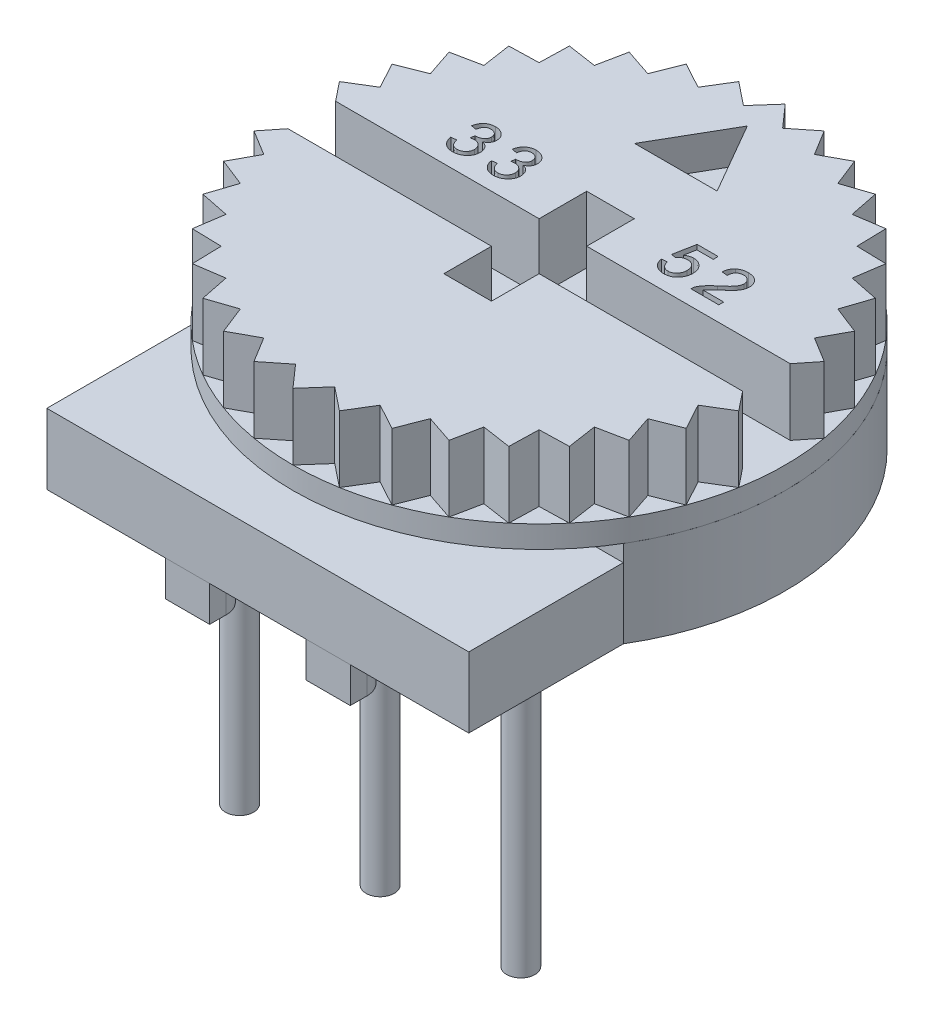
from build123d import *

# Parameters (mm, degrees)
EXTRUDE_START          = 0.64
EXTRUDE_1_DEPTH        = 1.27
EXTRUDE_2_DEPTH        = 0.3
EXTRUDE_START_2        = 2.21
SKETCH_3_R             = 4.445
EXTRUDE_3_DEPTH        = 1.6
SKETCH_4_R             = 1
EXTRUDE_4_DEPTH        = 0.64
EXTRUDE_4_2_DEPTH      = 0.64
EXTRUDE_4_3_DEPTH      = 0.64
EXTRUDE_4_4_DEPTH      = 0.64
EXTRUDE_4_5_DEPTH      = 0.64
EXTRUDE_5_DEPTH        = 0.64
EXTRUDE_5_DEPTH_BACK   = 4.75
SKETCH_5_R             = 0.255
EXTRUDE_5_2_DEPTH      = 0.64
EXTRUDE_5_2_DEPTH_BACK = 4.75
EXTRUDE_5_3_DEPTH      = 0.64
EXTRUDE_5_3_DEPTH_BACK = 4.75
SKETCH_6_R             = 6
CUT_EXTRUDE_1_DEPTH    = 1.2
CUT_EXTRUDE_START      = 3.81
CUT_EXTRUDE_2_DEPTH    = 0.6
CUT_EXTRUDE_3_DEPTH    = 0.3


with BuildPart() as part:
    # Эскиз1 → Бобышка-Вытянуть1 (new body)
    with BuildSketch(Plane(origin=(0, 0, 0), x_dir=(1, 0, 0), z_dir=(0, 1, 0)).offset(EXTRUDE_START)):
        with BuildLine():
            Line((-3.81, -2.28952506), (-3.81, -5.08))
            Line((-3.81, -5.08), (3.81, -5.08))
            Line((3.81, -5.08), (3.81, -2.28952506))
            ThreePointArc((3.81, -2.28952506), (0, 4.445), (-3.81, -2.28952506))
        make_face()
    extrude(amount=EXTRUDE_1_DEPTH)

    # Эскиз2 → Бобышка-Вытянуть2 (add)
    with BuildSketch(Plane(origin=(0, 1.91, 1.91), x_dir=(1, 0, 0), z_dir=(0, 1, 0))):
        with BuildLine():
            Line((-3.81, -0.37952506), (3.81, -0.37952506))
            ThreePointArc((3.81, -0.37952506), (0, 6.355), (-3.81, -0.37952506))
        make_face()
    extrude(amount=EXTRUDE_2_DEPTH)


with BuildPart() as body_2:
    # Эскиз3 → Бобышка-Вытянуть3 (new body)
    with BuildSketch(Plane(origin=(0, 0, 0), x_dir=(1, 0, 0), z_dir=(0, 1, 0)).offset(EXTRUDE_START_2)):
        with Locations(Location((0, 0, 0), (0, 0, 270))):
            Circle(SKETCH_3_R)
    extrude(amount=EXTRUDE_3_DEPTH)

    # Эскиз6 → Вырез-Вытянуть1 (cut)
    with BuildSketch(Plane(origin=(0, 3.81, -3.81), x_dir=(1, 0, 0), z_dir=(0, -1, 0))):
        with Locations((0, 3.81)):
            Circle(SKETCH_6_R)
        Polygon((0, -0.635), (-0.353852316, -0.234550474), (-0.77186615, -0.567470462), (-1.050805323, -0.111658855), (-1.520279537, -0.366933699), (-1.715830143, 0.130390385), (-2.2225, -0.03948292), (-2.328720332, 0.4842427), (-2.857190925, 0.40493245), (-2.870853532, 0.939146468), (-3.40506755, 0.952809075), (-3.3257573, 1.481279668), (-3.84948292, 1.5875), (-3.679609615, 2.094169857), (-4.176933699, 2.289720463), (-3.921658855, 2.759194677), (-4.377470462, 3.03813385), (-4.105196999, 3.38), (-0.43, 3.38), (-0.43, 2.52), (0.43, 2.52), (0.43, 3.38), (4.105196999, 3.38), (4.377470462, 3.03813385), (3.921658855, 2.759194677), (4.176933699, 2.289720463), (3.679609615, 2.094169857), (3.84948292, 1.5875), (3.3257573, 1.481279668), (3.40506755, 0.952809075), (2.870853532, 0.939146468), (2.857190925, 0.40493245), (2.328720332, 0.4842427), (2.2225, -0.03948292), (1.715830143, 0.130390385), (1.520279537, -0.366933699), (1.050805323, -0.111658855), (0.77186615, -0.567470462), (0.353852316, -0.234550474), align=None, mode=Mode.SUBTRACT)
        Polygon((-4.377470462, 4.58186615), (-4.105196999, 4.24), (-0.43, 4.24), (-0.43, 5.1), (0.43, 5.1), (0.43, 4.24), (4.105196999, 4.24), (4.377470462, 4.58186615), (3.921658855, 4.860805323), (4.176933699, 5.330279537), (3.679609615, 5.525830143), (3.84948292, 6.0325), (3.3257573, 6.138720332), (3.40506755, 6.667190925), (2.870853532, 6.680853532), (2.857190925, 7.21506755), (2.328720332, 7.1357573), (2.2225, 7.65948292), (1.715830143, 7.489609615), (1.520279537, 7.986933699), (1.050805323, 7.731658855), (0.77186615, 8.187470462), (0.353852316, 7.854550474), (0, 8.255), (-0.353852316, 7.854550474), (-0.77186615, 8.187470462), (-1.050805323, 7.731658855), (-1.520279537, 7.986933699), (-1.715830143, 7.489609615), (-2.2225, 7.65948292), (-2.328720332, 7.1357573), (-2.857190925, 7.21506755), (-2.870853532, 6.680853532), (-3.40506755, 6.667190925), (-3.3257573, 6.138720332), (-3.84948292, 6.0325), (-3.679609615, 5.525830143), (-4.176933699, 5.330279537), (-3.921658855, 4.860805323), align=None, mode=Mode.SUBTRACT)
    extrude(amount=CUT_EXTRUDE_1_DEPTH, mode=Mode.SUBTRACT)

    # Эскиз7 → Вырез-Вытянуть2 (cut)
    with BuildSketch(Plane(origin=(0, 0, 0), x_dir=(1, 0, 0), z_dir=(0, 1, 0)).offset(CUT_EXTRUDE_START)):
        Polygon((0, 3.76), (-0.744781847, 2.47), (0.744781847, 2.47), align=None)
    extrude(amount=-CUT_EXTRUDE_2_DEPTH, mode=Mode.SUBTRACT)

    # Эскиз8 → Вырез-Вытянуть3 (cut)
    with BuildSketch(Plane(origin=(0, 0, 0), x_dir=(1, 0, 0), z_dir=(0, 1, 0)).offset(CUT_EXTRUDE_START)):
        with BuildLine():
            Line((-2.501985822, 0.907038993), (-2.40690864, 0.919541025))
            add(Edge.make_bspline(
                [(-2.40690864, 0.919541025), (-2.405644351, 0.913657796), (-2.403175537, 0.902169439), (-2.39834592, 0.885699646), (-2.392970764, 0.870309421), (-2.386847582, 0.856085424), (-2.379831703, 0.843084522), (-2.372294366, 0.831093845), (-2.363915838, 0.820249984), (-2.35483828, 0.810450789), (-2.344863046, 0.801980649), (-2.334355165, 0.794448083), (-2.322966638, 0.788275038), (-2.310909145, 0.78320574), (-2.298172434, 0.779108802), (-2.284654514, 0.776412792), (-2.270460532, 0.774670777), (-2.2607482, 0.774425987), (-2.255803833, 0.774301369)],
                knots=[0, 0, 0, 0, 1.25215365, 2.445118067, 3.569595109, 4.643898417, 5.664387673, 6.64176914, 7.588516002, 8.512830437, 9.416505071, 10.307849468, 11.199258191, 12.106226295, 13.027433782, 13.978832694, 14.971061312, 16, 16, 16, 16], degree=3))
            add(Edge.make_bspline(
                [(-2.255803833, 0.774301369), (-2.250499607, 0.774475489), (-2.240008423, 0.774819881), (-2.224526828, 0.776778658), (-2.209648892, 0.780374105), (-2.195334767, 0.785353184), (-2.181578723, 0.791694865), (-2.168331978, 0.799421779), (-2.155890017, 0.808838811), (-2.143823297, 0.819162981), (-2.133017033, 0.830846954), (-2.123392866, 0.843229205), (-2.115056093, 0.856275085), (-2.108457683, 0.870196614), (-2.103370893, 0.88480763), (-2.099604129, 0.900037795), (-2.097447851, 0.916032165), (-2.097139121, 0.926943291), (-2.096981722, 0.932506095)],
                knots=[0, 0, 0, 0, 1.019841494, 2.017136108, 2.993418084, 3.956740548, 4.925832977, 5.90111261, 6.898014859, 7.921398643, 8.949977907, 9.950943466, 10.933218023, 11.919665724, 12.904922903, 13.902756767, 14.930765338, 16, 16, 16, 16], degree=3))
            add(Edge.make_bspline(
                [(-2.096981722, 0.932506095), (-2.09706827, 0.937711239), (-2.097238734, 0.947963224), (-2.099537355, 0.962934875), (-2.10290923, 0.977315591), (-2.107663642, 0.991050748), (-2.113893368, 1.004053995), (-2.121402738, 1.016436902), (-2.130299077, 1.028139768), (-2.137191539, 1.035263821), (-2.140661661, 1.038850541)],
                knots=[0, 0, 0, 0, 1.055738822, 2.07936994, 3.067371846, 4.051723283, 5.023470754, 5.988967532, 6.98751311, 8, 8, 8, 8], degree=3))
            add(Edge.make_bspline(
                [(-2.140661661, 1.038850541), (-2.144306094, 1.042213096), (-2.151521969, 1.048870861), (-2.16329474, 1.05754641), (-2.17571264, 1.064768971), (-2.188613289, 1.070940279), (-2.202408744, 1.075566782), (-2.217178878, 1.078990189), (-2.233110948, 1.08099687), (-2.244119221, 1.081194174), (-2.249784336, 1.081295712)],
                knots=[0, 0, 0, 0, 0.988530191, 1.957261951, 2.909383301, 3.850436006, 4.804490823, 5.805143527, 6.870475691, 8, 8, 8, 8], degree=3))
            add(Edge.make_bspline(
                [(-2.249784336, 1.081295712), (-2.254729284, 1.081174596), (-2.26511934, 1.080920113), (-2.281362147, 1.078752771), (-2.298970308, 1.07533309), (-2.311074132, 1.072252682), (-2.317387916, 1.070645832)],
                knots=[0, 0, 0, 0, 0.864458614, 1.816353425, 2.860932338, 4, 4, 4, 4], degree=3))
            Line((-2.317387916, 1.070645832), (-2.306738037, 1.149671023))
            Line((-2.306738037, 1.149671023), (-2.291920814, 1.149671023))
            add(Edge.make_bspline(
                [(-2.291920814, 1.149671023), (-2.281908836, 1.150038642), (-2.262312444, 1.150758182), (-2.233916972, 1.156929023), (-2.207447857, 1.167116071), (-2.1870926, 1.178716755), (-2.172340709, 1.189959506), (-2.162732901, 1.199557805), (-2.154596956, 1.210203868), (-2.147917802, 1.221815624), (-2.14284499, 1.234462895), (-2.13908188, 1.24801206), (-2.136947876, 1.262636389), (-2.136648599, 1.272729474), (-2.136494317, 1.277932611)],
                knots=[0, 0, 0, 0, 1.590047677, 3.112191915, 4.592935101, 6.084007372, 6.818461429, 7.535499496, 8.2355482, 8.942536248, 9.657800044, 10.395842031, 11.173032543, 12, 12, 12, 12], degree=3))
            add(Edge.make_bspline(
                [(-2.136494317, 1.277932611), (-2.136619309, 1.282464939), (-2.136861694, 1.291254008), (-2.138557954, 1.304093252), (-2.141528509, 1.316119811), (-2.145449001, 1.327553546), (-2.150982549, 1.338001507), (-2.157343132, 1.347891481), (-2.164882385, 1.357048183), (-2.176689469, 1.367761123), (-2.192712731, 1.379395627), (-2.214107144, 1.389448426), (-2.237158661, 1.395492255), (-2.253092239, 1.396242634), (-2.261205945, 1.396624742)],
                knots=[0, 0, 0, 0, 0.846154037, 1.640857849, 2.411992166, 3.156338538, 3.890952843, 4.612962146, 5.349645879, 6.097269828, 7.584598448, 9.028361454, 10.486780392, 12, 12, 12, 12], degree=3))
            add(Edge.make_bspline(
                [(-2.261205945, 1.396624742), (-2.265941947, 1.396479956), (-2.275232891, 1.396195917), (-2.288845513, 1.394742828), (-2.301626515, 1.391896189), (-2.313722162, 1.388233046), (-2.324993347, 1.38326957), (-2.335498967, 1.37720153), (-2.345384597, 1.370248959), (-2.354320856, 1.361982869), (-2.362565267, 1.352686373), (-2.369895989, 1.34224472), (-2.376861602, 1.330971723), (-2.382568944, 1.318336548), (-2.387932399, 1.304795904), (-2.392109882, 1.290018356), (-2.395912528, 1.274283813), (-2.397670873, 1.263336021), (-2.398573952, 1.257713275)],
                knots=[0, 0, 0, 0, 1.047698147, 2.05534196, 3.021606887, 3.939224836, 4.846058591, 5.73792374, 6.61876291, 7.512657664, 8.423479399, 9.361190499, 10.330932173, 11.348864526, 12.422194489, 13.549004293, 14.741177672, 16, 16, 16, 16], degree=3))
            Line((-2.398573952, 1.257713275), (-2.492416365, 1.273919613))
            add(Edge.make_bspline(
                [(-2.492416365, 1.273919613), (-2.490926561, 1.281865412), (-2.488021886, 1.29735735), (-2.481994505, 1.319733397), (-2.474459047, 1.340672408), (-2.465276194, 1.360122295), (-2.454996064, 1.378286564), (-2.44317597, 1.394958758), (-2.429833812, 1.41011232), (-2.415168968, 1.423883062), (-2.399296787, 1.436005668), (-2.382475556, 1.446637702), (-2.364670307, 1.455568296), (-2.345989266, 1.462998359), (-2.326408754, 1.468755207), (-2.305887111, 1.472697023), (-2.284474667, 1.4752646), (-2.26985689, 1.475520237), (-2.262440714, 1.475649933)],
                knots=[0, 0, 0, 0, 1.151933863, 2.245927202, 3.299073903, 4.319309306, 5.307986268, 6.270398158, 7.226503678, 8.18108947, 9.132967531, 10.068836926, 11.013314105, 11.96787173, 12.930842188, 13.917395712, 14.943412426, 16, 16, 16, 16], degree=3))
            add(Edge.make_bspline(
                [(-2.262440714, 1.475649933), (-2.254922121, 1.475460825), (-2.240044918, 1.475086634), (-2.218135904, 1.472452289), (-2.197001473, 1.467975698), (-2.176762165, 1.461623555), (-2.157275529, 1.453534369), (-2.138630425, 1.443654641), (-2.120736227, 1.432002215), (-2.103966896, 1.418648161), (-2.088403134, 1.404196699), (-2.07488156, 1.388483927), (-2.063419813, 1.371914544), (-2.053911799, 1.354568805), (-2.046562396, 1.336340438), (-2.0415229, 1.317200456), (-2.038343476, 1.297228818), (-2.037924964, 1.283603975), (-2.037712829, 1.276697842)],
                knots=[0, 0, 0, 0, 1.080881225, 2.138763162, 3.167379081, 4.182744089, 5.184191339, 6.196723254, 7.212303792, 8.249712366, 9.275371759, 10.261429635, 11.223757434, 12.167135395, 13.099809543, 14.041823507, 15.00744346, 16, 16, 16, 16], degree=3))
            add(Edge.make_bspline(
                [(-2.037712829, 1.276697842), (-2.03798463, 1.268493386), (-2.038517751, 1.252400896), (-2.043455337, 1.228981216), (-2.051578623, 1.206945589), (-2.062866169, 1.186226186), (-2.077786153, 1.167223022), (-2.096144392, 1.149853801), (-2.118228696, 1.134424264), (-2.134736006, 1.12596256), (-2.143285544, 1.121580037)],
                knots=[0, 0, 0, 0, 0.987492271, 1.936899646, 2.868413649, 3.808814761, 4.767243983, 5.766897543, 6.843421767, 8, 8, 8, 8], degree=3))
            add(Edge.make_bspline(
                [(-2.143285544, 1.121580037), (-2.137654276, 1.12038866), (-2.126576692, 1.118045036), (-2.110622959, 1.112959632), (-2.095719565, 1.106409554), (-2.081769358, 1.098659598), (-2.068689821, 1.089733046), (-2.056809274, 1.079251044), (-2.045712723, 1.067684431), (-2.036021266, 1.05465431), (-2.027060141, 1.041045247), (-2.019348794, 1.026829565), (-2.012857342, 1.012207367), (-2.007354458, 0.997297309), (-2.003475294, 0.981841714), (-2.000223572, 0.966115889), (-1.998610008, 0.949878017), (-1.998337466, 0.938939841), (-1.998200234, 0.933432172)],
                knots=[0, 0, 0, 0, 1.067131883, 2.099215043, 3.099123068, 4.081576142, 5.055651918, 6.029634208, 7.015141117, 8.022850411, 9.036550921, 10.03573015, 11.018183224, 12.00221067, 12.978947031, 13.970808847, 14.97824702, 16, 16, 16, 16], degree=3))
            add(Edge.make_bspline(
                [(-1.998200234, 0.933432172), (-1.998443868, 0.92508559), (-1.998922875, 0.908675465), (-2.002514264, 0.884593489), (-2.008594923, 0.861647131), (-2.0168699, 0.839644174), (-2.028070828, 0.818959188), (-2.041109562, 0.799027081), (-2.056957149, 0.78042788), (-2.074813227, 0.763046374), (-2.094344038, 0.747265569), (-2.114914563, 0.733223833), (-2.136570724, 0.721529218), (-2.159078528, 0.711868726), (-2.182498369, 0.704425723), (-2.206902033, 0.69923801), (-2.232198097, 0.695871696), (-2.249413421, 0.695476184), (-2.258119024, 0.695276178)],
                knots=[0, 0, 0, 0, 1.020466717, 2.006328551, 2.969258575, 3.919193331, 4.873285916, 5.83999038, 6.826795306, 7.854547782, 8.883320379, 9.893671155, 10.895899107, 11.888064533, 12.884926533, 13.89559068, 14.935823028, 16, 16, 16, 16], degree=3))
            add(Edge.make_bspline(
                [(-2.258119024, 0.695276178), (-2.266514424, 0.695433193), (-2.282998584, 0.695741487), (-2.307107981, 0.698777869), (-2.330045612, 0.70351683), (-2.351835599, 0.710154005), (-2.372397677, 0.718830679), (-2.391867351, 0.729385714), (-2.410105191, 0.741931679), (-2.427010156, 0.756257142), (-2.442384661, 0.771977868), (-2.456147671, 0.788675018), (-2.468278692, 0.806202262), (-2.478696388, 0.824609983), (-2.487156179, 0.843991857), (-2.493971023, 0.864177463), (-2.499195774, 0.885230761), (-2.50104797, 0.899708334), (-2.501985822, 0.907038993)],
                knots=[0, 0, 0, 0, 1.131891259, 2.222440238, 3.271761995, 4.288072932, 5.289491361, 6.276963531, 7.270173475, 8.269762916, 9.261007282, 10.232154035, 11.184979397, 12.132661093, 13.08034279, 14.032738467, 15.00388522, 16, 16, 16, 16], degree=3))
        make_face()
        with BuildLine():
            Line((-1.767051552, 0.907038993), (-1.67197437, 0.919541025))
            add(Edge.make_bspline(
                [(-1.67197437, 0.919541025), (-1.670710082, 0.913657796), (-1.668241268, 0.902169439), (-1.66341165, 0.885699646), (-1.658036494, 0.870309421), (-1.651913312, 0.856085424), (-1.644897433, 0.843084522), (-1.637360096, 0.831093845), (-1.628981568, 0.820249984), (-1.61990401, 0.810450789), (-1.609928777, 0.801980649), (-1.599420896, 0.794448083), (-1.588032368, 0.788275038), (-1.575974876, 0.78320574), (-1.563238164, 0.779108802), (-1.549720244, 0.776412792), (-1.535526262, 0.774670777), (-1.52581393, 0.774425987), (-1.520869563, 0.774301369)],
                knots=[0, 0, 0, 0, 1.25215365, 2.445118067, 3.569595109, 4.643898417, 5.664387673, 6.64176914, 7.588516002, 8.512830437, 9.416505071, 10.307849468, 11.199258191, 12.106226295, 13.027433782, 13.978832694, 14.971061312, 16, 16, 16, 16], degree=3))
            add(Edge.make_bspline(
                [(-1.520869563, 0.774301369), (-1.515565337, 0.774475489), (-1.505074153, 0.774819881), (-1.489592558, 0.776778658), (-1.474714623, 0.780374105), (-1.460400497, 0.785353184), (-1.446644453, 0.791694865), (-1.433397708, 0.799421779), (-1.420955747, 0.808838811), (-1.408889027, 0.819162981), (-1.398082763, 0.830846954), (-1.388458596, 0.843229205), (-1.380121823, 0.856275085), (-1.373523413, 0.870196614), (-1.368436623, 0.88480763), (-1.364669859, 0.900037795), (-1.362513581, 0.916032165), (-1.362204851, 0.926943291), (-1.362047452, 0.932506095)],
                knots=[0, 0, 0, 0, 1.019841494, 2.017136108, 2.993418084, 3.956740548, 4.925832977, 5.90111261, 6.898014859, 7.921398643, 8.949977907, 9.950943466, 10.933218023, 11.919665724, 12.904922903, 13.902756767, 14.930765338, 16, 16, 16, 16], degree=3))
            add(Edge.make_bspline(
                [(-1.362047452, 0.932506095), (-1.362134, 0.937711239), (-1.362304464, 0.947963224), (-1.364603085, 0.962934875), (-1.36797496, 0.977315591), (-1.372729372, 0.991050748), (-1.378959098, 1.004053995), (-1.386468468, 1.016436902), (-1.395364807, 1.028139768), (-1.402257269, 1.035263821), (-1.405727391, 1.038850541)],
                knots=[0, 0, 0, 0, 1.055738822, 2.07936994, 3.067371846, 4.051723283, 5.023470754, 5.988967532, 6.98751311, 8, 8, 8, 8], degree=3))
            add(Edge.make_bspline(
                [(-1.405727391, 1.038850541), (-1.409371824, 1.042213096), (-1.416587699, 1.048870861), (-1.42836047, 1.05754641), (-1.44077837, 1.064768971), (-1.453679019, 1.070940279), (-1.467474474, 1.075566782), (-1.482244608, 1.078990189), (-1.498176678, 1.08099687), (-1.509184952, 1.081194174), (-1.514850066, 1.081295712)],
                knots=[0, 0, 0, 0, 0.988530191, 1.957261951, 2.909383301, 3.850436006, 4.804490823, 5.805143527, 6.870475691, 8, 8, 8, 8], degree=3))
            add(Edge.make_bspline(
                [(-1.514850066, 1.081295712), (-1.519795014, 1.081174596), (-1.530185071, 1.080920113), (-1.546427877, 1.078752771), (-1.564036038, 1.07533309), (-1.576139862, 1.072252682), (-1.582453647, 1.070645832)],
                knots=[0, 0, 0, 0, 0.864458614, 1.816353425, 2.860932338, 4, 4, 4, 4], degree=3))
            Line((-1.582453647, 1.070645832), (-1.571803767, 1.149671023))
            Line((-1.571803767, 1.149671023), (-1.556986544, 1.149671023))
            add(Edge.make_bspline(
                [(-1.556986544, 1.149671023), (-1.546974566, 1.150038642), (-1.527378174, 1.150758182), (-1.498982702, 1.156929023), (-1.472513587, 1.167116071), (-1.45215833, 1.178716755), (-1.437406439, 1.189959506), (-1.427798631, 1.199557805), (-1.419662686, 1.210203868), (-1.412983532, 1.221815624), (-1.40791072, 1.234462895), (-1.40414761, 1.24801206), (-1.402013606, 1.262636389), (-1.401714329, 1.272729474), (-1.401560047, 1.277932611)],
                knots=[0, 0, 0, 0, 1.590047677, 3.112191915, 4.592935101, 6.084007372, 6.818461429, 7.535499496, 8.2355482, 8.942536248, 9.657800044, 10.395842031, 11.173032543, 12, 12, 12, 12], degree=3))
            add(Edge.make_bspline(
                [(-1.401560047, 1.277932611), (-1.401685039, 1.282464939), (-1.401927424, 1.291254008), (-1.403623684, 1.304093252), (-1.406594239, 1.316119811), (-1.410514731, 1.327553546), (-1.416048279, 1.338001507), (-1.422408862, 1.347891481), (-1.429948115, 1.357048183), (-1.441755199, 1.367761123), (-1.457778461, 1.379395627), (-1.479172874, 1.389448426), (-1.502224391, 1.395492255), (-1.518157969, 1.396242634), (-1.526271675, 1.396624742)],
                knots=[0, 0, 0, 0, 0.846154037, 1.640857849, 2.411992166, 3.156338538, 3.890952843, 4.612962146, 5.349645879, 6.097269828, 7.584598448, 9.028361454, 10.486780392, 12, 12, 12, 12], degree=3))
            add(Edge.make_bspline(
                [(-1.526271675, 1.396624742), (-1.531007678, 1.396479956), (-1.540298621, 1.396195917), (-1.553911243, 1.394742828), (-1.566692245, 1.391896189), (-1.578787892, 1.388233046), (-1.590059077, 1.38326957), (-1.600564697, 1.37720153), (-1.610450327, 1.370248959), (-1.619386586, 1.361982869), (-1.627630997, 1.352686373), (-1.634961719, 1.34224472), (-1.641927332, 1.330971723), (-1.647634674, 1.318336548), (-1.652998129, 1.304795904), (-1.657175613, 1.290018356), (-1.660978259, 1.274283813), (-1.662736603, 1.263336021), (-1.663639682, 1.257713275)],
                knots=[0, 0, 0, 0, 1.047698147, 2.05534196, 3.021606887, 3.939224836, 4.846058591, 5.73792374, 6.61876291, 7.512657664, 8.423479399, 9.361190499, 10.330932173, 11.348864526, 12.422194489, 13.549004293, 14.741177672, 16, 16, 16, 16], degree=3))
            Line((-1.663639682, 1.257713275), (-1.757482095, 1.273919613))
            add(Edge.make_bspline(
                [(-1.757482095, 1.273919613), (-1.755992291, 1.281865412), (-1.753087617, 1.29735735), (-1.747060235, 1.319733397), (-1.739524777, 1.340672408), (-1.730341924, 1.360122295), (-1.720061794, 1.378286564), (-1.708241701, 1.394958758), (-1.694899542, 1.41011232), (-1.680234698, 1.423883062), (-1.664362517, 1.436005668), (-1.647541286, 1.446637702), (-1.629736037, 1.455568296), (-1.611054996, 1.462998359), (-1.591474485, 1.468755207), (-1.570952841, 1.472697023), (-1.549540397, 1.4752646), (-1.53492262, 1.475520237), (-1.527506444, 1.475649933)],
                knots=[0, 0, 0, 0, 1.151933863, 2.245927202, 3.299073903, 4.319309306, 5.307986268, 6.270398158, 7.226503678, 8.18108947, 9.132967531, 10.068836926, 11.013314105, 11.96787173, 12.930842188, 13.917395712, 14.943412426, 16, 16, 16, 16], degree=3))
            add(Edge.make_bspline(
                [(-1.527506444, 1.475649933), (-1.519987851, 1.475460825), (-1.505110648, 1.475086634), (-1.483201635, 1.472452289), (-1.462067203, 1.467975698), (-1.441827895, 1.461623555), (-1.422341259, 1.453534369), (-1.403696155, 1.443654641), (-1.385801957, 1.432002215), (-1.369032627, 1.418648161), (-1.353468864, 1.404196699), (-1.339947291, 1.388483927), (-1.328485543, 1.371914544), (-1.318977529, 1.354568805), (-1.311628126, 1.336340438), (-1.30658863, 1.317200456), (-1.303409207, 1.297228818), (-1.302990694, 1.283603975), (-1.302778559, 1.276697842)],
                knots=[0, 0, 0, 0, 1.080881225, 2.138763162, 3.167379081, 4.182744089, 5.184191339, 6.196723254, 7.212303792, 8.249712366, 9.275371759, 10.261429635, 11.223757434, 12.167135395, 13.099809543, 14.041823507, 15.00744346, 16, 16, 16, 16], degree=3))
            add(Edge.make_bspline(
                [(-1.302778559, 1.276697842), (-1.303050361, 1.268493386), (-1.303583481, 1.252400896), (-1.308521067, 1.228981216), (-1.316644353, 1.206945589), (-1.327931899, 1.186226186), (-1.342851883, 1.167223022), (-1.361210122, 1.149853801), (-1.383294426, 1.134424264), (-1.399801736, 1.12596256), (-1.408351274, 1.121580037)],
                knots=[0, 0, 0, 0, 0.987492271, 1.936899646, 2.868413649, 3.808814761, 4.767243983, 5.766897543, 6.843421767, 8, 8, 8, 8], degree=3))
            add(Edge.make_bspline(
                [(-1.408351274, 1.121580037), (-1.402720006, 1.12038866), (-1.391642422, 1.118045036), (-1.375688689, 1.112959632), (-1.360785295, 1.106409554), (-1.346835088, 1.098659598), (-1.333755551, 1.089733046), (-1.321875005, 1.079251044), (-1.310778453, 1.067684431), (-1.301086996, 1.05465431), (-1.292125871, 1.041045247), (-1.284414525, 1.026829565), (-1.277923072, 1.012207367), (-1.272420188, 0.997297309), (-1.268541024, 0.981841714), (-1.265289302, 0.966115889), (-1.263675738, 0.949878017), (-1.263403196, 0.938939841), (-1.263265964, 0.933432172)],
                knots=[0, 0, 0, 0, 1.067131883, 2.099215043, 3.099123068, 4.081576142, 5.055651918, 6.029634208, 7.015141117, 8.022850411, 9.036550921, 10.03573015, 11.018183224, 12.00221067, 12.978947031, 13.970808847, 14.97824702, 16, 16, 16, 16], degree=3))
            add(Edge.make_bspline(
                [(-1.263265964, 0.933432172), (-1.263509598, 0.92508559), (-1.263988605, 0.908675465), (-1.267579994, 0.884593489), (-1.273660653, 0.861647131), (-1.28193563, 0.839644174), (-1.293136558, 0.818959188), (-1.306175292, 0.799027081), (-1.322022879, 0.78042788), (-1.339878957, 0.763046374), (-1.359409768, 0.747265569), (-1.379980293, 0.733223833), (-1.401636454, 0.721529218), (-1.424144258, 0.711868726), (-1.447564099, 0.704425723), (-1.471967763, 0.69923801), (-1.497263827, 0.695871696), (-1.514479151, 0.695476184), (-1.523184754, 0.695276178)],
                knots=[0, 0, 0, 0, 1.020466717, 2.006328551, 2.969258575, 3.919193331, 4.873285916, 5.83999038, 6.826795306, 7.854547782, 8.883320379, 9.893671155, 10.895899107, 11.888064533, 12.884926533, 13.89559068, 14.935823028, 16, 16, 16, 16], degree=3))
            add(Edge.make_bspline(
                [(-1.523184754, 0.695276178), (-1.531580155, 0.695433193), (-1.548064314, 0.695741487), (-1.572173712, 0.698777869), (-1.595111343, 0.70351683), (-1.616901329, 0.710154005), (-1.637463407, 0.718830679), (-1.656933082, 0.729385714), (-1.675170921, 0.741931679), (-1.692075886, 0.756257142), (-1.707450391, 0.771977868), (-1.721213402, 0.788675018), (-1.733344422, 0.806202262), (-1.743762118, 0.824609983), (-1.75222191, 0.843991857), (-1.759036753, 0.864177463), (-1.764261505, 0.885230761), (-1.7661137, 0.899708334), (-1.767051552, 0.907038993)],
                knots=[0, 0, 0, 0, 1.131891259, 2.222440238, 3.271761995, 4.288072932, 5.289491361, 6.276963531, 7.270173475, 8.269762916, 9.261007282, 10.232154035, 11.184979397, 12.132661093, 13.08034279, 14.032738467, 15.00388522, 16, 16, 16, 16], degree=3))
        make_face()
        with BuildLine():
            Line((1.307429651, 0.90518684), (1.406828523, 0.912595452))
            add(Edge.make_bspline(
                [(1.406828523, 0.912595452), (1.407726274, 0.906869815), (1.409468971, 0.895755315), (1.413337631, 0.879741168), (1.418255873, 0.864926628), (1.424153803, 0.851246657), (1.430931244, 0.838630347), (1.438811358, 0.827203129), (1.44763734, 0.816929576), (1.457438628, 0.807943513), (1.467983733, 0.800144002), (1.478848812, 0.793143437), (1.490314896, 0.787392968), (1.50212929, 0.782622397), (1.514370029, 0.778887357), (1.52703347, 0.776303385), (1.540079158, 0.774480955), (1.548974866, 0.77436154), (1.553457294, 0.774301369)],
                knots=[0, 0, 0, 0, 1.249067748, 2.424667078, 3.54705271, 4.610222465, 5.63263209, 6.629453051, 7.596709712, 8.546511456, 9.489292943, 10.42164286, 11.329389588, 12.250054795, 13.165829761, 14.08381861, 15.034461889, 16, 16, 16, 16], degree=3))
            add(Edge.make_bspline(
                [(1.553457294, 0.774301369), (1.559231145, 0.77441581), (1.570584715, 0.774640844), (1.587124199, 0.777414663), (1.602924865, 0.781557981), (1.617951853, 0.787449673), (1.632252438, 0.795056993), (1.645693073, 0.804413047), (1.658514577, 0.815276405), (1.670226035, 0.827917089), (1.680955095, 0.841633463), (1.690248799, 0.856318099), (1.698366291, 0.871577647), (1.704830999, 0.88768016), (1.709784511, 0.904487896), (1.713312621, 0.921995507), (1.715520825, 0.9402188), (1.715828024, 0.952616279), (1.715983711, 0.958899274)],
                knots=[0, 0, 0, 0, 1.008988117, 1.984051261, 2.924956246, 3.862541115, 4.800644177, 5.751780646, 6.722097308, 7.7344514, 8.760593165, 9.764228736, 10.770644745, 11.780074283, 12.793827566, 13.831663856, 14.901095515, 16, 16, 16, 16], degree=3))
            add(Edge.make_bspline(
                [(1.715983711, 0.958899274), (1.715814716, 0.965334981), (1.715485354, 0.97787787), (1.713529693, 0.996175263), (1.709994982, 1.013452902), (1.704838644, 1.029633176), (1.698583842, 1.044927901), (1.690632439, 1.059023238), (1.681292, 1.072093567), (1.670664355, 1.084065762), (1.658999094, 1.094925694), (1.646186891, 1.104146091), (1.632760031, 1.112314149), (1.618291538, 1.118811764), (1.602943271, 1.12370836), (1.586822168, 1.127247675), (1.569879172, 1.129466337), (1.558300396, 1.129762971), (1.552376871, 1.129914725)],
                knots=[0, 0, 0, 0, 1.15763473, 2.256175304, 3.305152242, 4.323645506, 5.306671854, 6.271986148, 7.22722391, 8.190895719, 9.147029492, 10.087268737, 11.025182741, 11.969466044, 12.932248857, 13.917885014, 14.934821687, 16, 16, 16, 16], degree=3))
            add(Edge.make_bspline(
                [(1.552376871, 1.129914725), (1.54500727, 1.129662955), (1.53065036, 1.129172475), (1.509730086, 1.125772738), (1.490173041, 1.119890962), (1.47194238, 1.111657925), (1.455037983, 1.101035697), (1.439639275, 1.087943606), (1.425308589, 1.07272944), (1.417374797, 1.061042834), (1.413311058, 1.055056879)],
                knots=[0, 0, 0, 0, 1.069378134, 2.083282909, 3.065914344, 4.024944712, 4.977851872, 5.952965674, 6.951495823, 8, 8, 8, 8], degree=3))
            Line((1.413311058, 1.055056879), (1.324562065, 1.065706758))
            Line((1.324562065, 1.065706758), (1.398185143, 1.455893635))
            Line((1.398185143, 1.455893635), (1.777876487, 1.455893635))
            Line((1.777876487, 1.455893635), (1.777876487, 1.366990296))
            Line((1.777876487, 1.366990296), (1.481840715, 1.366990296))
            Line((1.481840715, 1.366990296), (1.44309985, 1.161864363))
            add(Edge.make_bspline(
                [(1.44309985, 1.161864363), (1.44876287, 1.165594907), (1.459927769, 1.172949844), (1.477281803, 1.182497319), (1.494680045, 1.190711627), (1.512208177, 1.197428854), (1.529838641, 1.202473992), (1.547512116, 1.206264339), (1.565338274, 1.208451933), (1.577272379, 1.208777134), (1.583246086, 1.208939915)],
                knots=[0, 0, 0, 0, 1.083779032, 2.136719571, 3.163308835, 4.157763175, 5.133919324, 6.092133947, 7.045003185, 8, 8, 8, 8], degree=3))
            add(Edge.make_bspline(
                [(1.583246086, 1.208939915), (1.59097097, 1.208713775), (1.606276709, 1.20826571), (1.628823981, 1.205263312), (1.650437417, 1.199620384), (1.67141909, 1.19256766), (1.691388994, 1.182727762), (1.710766966, 1.171290795), (1.729068223, 1.157273378), (1.746528999, 1.141589681), (1.762530536, 1.124117487), (1.776463345, 1.105135151), (1.788532856, 1.085023), (1.798031266, 1.063340298), (1.805703988, 1.04048495), (1.810814615, 1.016185912), (1.814190763, 0.990686736), (1.814571176, 0.973213355), (1.814765199, 0.964301387)],
                knots=[0, 0, 0, 0, 0.985324326, 1.952277578, 2.892821764, 3.830798909, 4.769945844, 5.726467989, 6.696288994, 7.704421374, 8.716964428, 9.711747458, 10.703170494, 11.701862822, 12.724833945, 13.772487079, 14.863899138, 16, 16, 16, 16], degree=3))
            add(Edge.make_bspline(
                [(1.814765199, 0.964301387), (1.814567689, 0.955543813), (1.814177098, 0.938224929), (1.810760944, 0.912683681), (1.805643149, 0.887839023), (1.797980557, 0.86391008), (1.788347337, 0.840716171), (1.776633363, 0.818309613), (1.762606027, 0.796771953), (1.746717496, 0.776227559), (1.728943875, 0.75716293), (1.709021189, 0.740556815), (1.687401786, 0.726433013), (1.663852623, 0.715098934), (1.638718604, 0.706130141), (1.611737979, 0.699871137), (1.583056675, 0.695888489), (1.563297798, 0.695483964), (1.553148602, 0.695276178)],
                knots=[0, 0, 0, 0, 0.998180857, 1.9739917, 2.93362, 3.887312064, 4.834104183, 5.794539127, 6.76601965, 7.761144289, 8.753029812, 9.731781363, 10.711376514, 11.690057732, 12.705061318, 13.748110294, 14.843311327, 16, 16, 16, 16], degree=3))
            add(Edge.make_bspline(
                [(1.553148602, 0.695276178), (1.545270063, 0.69540662), (1.529781304, 0.69566306), (1.506971645, 0.698219061), (1.485021145, 0.702326694), (1.463978004, 0.708241217), (1.443770392, 0.715663363), (1.424422366, 0.7247572), (1.406024927, 0.735694192), (1.388399468, 0.747902675), (1.372121593, 0.761952456), (1.35764805, 0.777787047), (1.344644889, 0.794999508), (1.333685517, 0.814018819), (1.324466166, 0.834576494), (1.316879392, 0.856682227), (1.310934883, 0.880323009), (1.308615817, 0.896772951), (1.307429651, 0.90518684)],
                knots=[0, 0, 0, 0, 1.057065927, 2.078131428, 3.076243397, 4.051326069, 5.008244039, 5.96271726, 6.916065792, 7.877755458, 8.837211347, 9.79502582, 10.752093266, 11.726809112, 12.734335647, 13.771616904, 14.860216757, 16, 16, 16, 16], degree=3))
        make_face()
        with BuildLine():
            Line((2.53982132, 0.794057666), (2.53982132, 0.705154327))
            Line((2.53982132, 0.705154327), (2.036035731, 0.705154327))
            Line((2.036035731, 0.705154327), (2.036035731, 0.720125896))
            add(Edge.make_bspline(
                [(2.036035731, 0.720125896), (2.036185863, 0.72461269), (2.036493185, 0.733797266), (2.039046444, 0.74776814), (2.042579769, 0.762257338), (2.048251327, 0.777007332), (2.054987472, 0.792313906), (2.063339554, 0.808050541), (2.07338641, 0.824097187), (2.084536539, 0.84084533), (2.097647966, 0.857719228), (2.111989126, 0.875228883), (2.127933417, 0.89311447), (2.145394694, 0.911478581), (2.164346944, 0.930254173), (2.184854803, 0.949475151), (2.206808988, 0.969158238), (2.222196279, 0.982191339), (2.230048747, 0.988842413)],
                knots=[0, 0, 0, 0, 0.632870753, 1.295501908, 2.000066298, 2.735327521, 3.522116526, 4.360286005, 5.247130914, 6.193836106, 7.198989038, 8.261832211, 9.388439775, 10.580224752, 11.838380581, 13.153655843, 14.547448834, 16, 16, 16, 16], degree=3))
            add(Edge.make_bspline(
                [(2.230048747, 0.988842413), (2.239643099, 0.996735618), (2.258227082, 1.012024529), (2.28470733, 1.034629912), (2.308921495, 1.056161479), (2.330766674, 1.076570036), (2.350248968, 1.095896193), (2.367519007, 1.113996965), (2.382451495, 1.131001241), (2.395205954, 1.147112209), (2.40594999, 1.162653965), (2.415468465, 1.177616269), (2.423153838, 1.192628469), (2.429759998, 1.207190195), (2.434641704, 1.221701645), (2.438538984, 1.235878827), (2.440479818, 1.249993939), (2.440855083, 1.259303766), (2.441039832, 1.263887118)],
                knots=[0, 0, 0, 0, 1.671742638, 3.238117631, 4.684614157, 6.03153044, 7.260249573, 8.376754456, 9.39727162, 10.304414296, 11.139826786, 11.938968976, 12.688311074, 13.407397428, 14.08827816, 14.746503604, 15.382886949, 16, 16, 16, 16], degree=3))
            add(Edge.make_bspline(
                [(2.441039832, 1.263887118), (2.44094093, 1.268525757), (2.440746544, 1.277642806), (2.438620385, 1.291026213), (2.43540931, 1.303852132), (2.430978051, 1.316123372), (2.424989219, 1.327690303), (2.417663718, 1.33864454), (2.409230114, 1.349171004), (2.399449601, 1.358831103), (2.388962041, 1.367641469), (2.377936819, 1.375528675), (2.366307186, 1.381892247), (2.35443053, 1.387490323), (2.341960157, 1.391318234), (2.329236208, 1.394623258), (2.315956649, 1.396211942), (2.30696742, 1.396486414), (2.302437057, 1.396624742)],
                knots=[0, 0, 0, 0, 1.042577346, 2.049142129, 3.039949553, 4.013851483, 4.976550021, 5.96193575, 6.974073435, 8.005154502, 9.048309756, 10.053276604, 11.048063597, 12.026903653, 13.000392941, 13.977178478, 14.980544847, 16, 16, 16, 16], degree=3))
            add(Edge.make_bspline(
                [(2.302437057, 1.396624742), (2.296925061, 1.396527123), (2.286170895, 1.396336663), (2.270525181, 1.394246839), (2.255743865, 1.391030011), (2.241791487, 1.386526497), (2.228584971, 1.380869204), (2.21635545, 1.373695933), (2.204954497, 1.36528158), (2.194514394, 1.355584177), (2.185106005, 1.344769685), (2.176791706, 1.332992731), (2.170060623, 1.319996564), (2.164268545, 1.306149023), (2.160043554, 1.291145949), (2.156738855, 1.275277271), (2.15491517, 1.258321694), (2.154689537, 1.246707314), (2.154573517, 1.240735207)],
                knots=[0, 0, 0, 0, 1.087066716, 2.120919133, 3.108681372, 4.068661442, 5.009828773, 5.937927913, 6.859786911, 7.800899483, 8.7435441, 9.684218487, 10.637950864, 11.625869613, 12.641110662, 13.7083217, 14.821620425, 16, 16, 16, 16], degree=3))
            Line((2.154573517, 1.240735207), (2.055792029, 1.251539432))
            add(Edge.make_bspline(
                [(2.055792029, 1.251539432), (2.056030051, 1.260041107), (2.056495279, 1.276658089), (2.060120549, 1.300987675), (2.066110165, 1.324022577), (2.07451033, 1.345818145), (2.085196319, 1.366293746), (2.098178471, 1.385364442), (2.113600445, 1.402825975), (2.125334133, 1.413058917), (2.13126726, 1.418233193)],
                knots=[0, 0, 0, 0, 1.076859376, 2.10477961, 3.108796072, 4.086958108, 5.057903712, 6.028849315, 7.003289897, 8, 8, 8, 8], degree=3))
            add(Edge.make_bspline(
                [(2.13126726, 1.418233193), (2.137050328, 1.422822464), (2.148595618, 1.431984461), (2.167384043, 1.443695536), (2.187218212, 1.453643794), (2.208187705, 1.461636772), (2.230211783, 1.468042916), (2.253365514, 1.47243868), (2.277627333, 1.475112203), (2.294146786, 1.475468034), (2.302591403, 1.475649933)],
                knots=[0, 0, 0, 0, 0.959486463, 1.915514127, 2.873015645, 3.840956306, 4.829852076, 5.852048187, 6.901983673, 8, 8, 8, 8], degree=3))
            add(Edge.make_bspline(
                [(2.302591403, 1.475649933), (2.311655476, 1.47549759), (2.329319439, 1.475200708), (2.355018014, 1.472159319), (2.379269703, 1.467465743), (2.401956388, 1.460672594), (2.423168769, 1.45204802), (2.442705315, 1.441255765), (2.46091328, 1.428820664), (2.477197324, 1.414214034), (2.491753656, 1.398356008), (2.504765892, 1.381644731), (2.51554506, 1.363838449), (2.524410475, 1.345159984), (2.531390836, 1.325677605), (2.536347562, 1.305249372), (2.539336509, 1.283938684), (2.539658264, 1.269401813), (2.53982132, 1.262034965)],
                knots=[0, 0, 0, 0, 1.21174263, 2.361430296, 3.455840187, 4.511672251, 5.523703299, 6.512185335, 7.491355141, 8.466211936, 9.430373673, 10.367617463, 11.293987516, 12.20811244, 13.128740368, 14.056642456, 15.01516498, 16, 16, 16, 16], degree=3))
            add(Edge.make_bspline(
                [(2.53982132, 1.262034965), (2.53943397, 1.251449047), (2.538655056, 1.230162002), (2.531314969, 1.19844941), (2.520240859, 1.166827009), (2.506977721, 1.140472633), (2.492711329, 1.118523605), (2.478201685, 1.099655046), (2.459864988, 1.078817174), (2.438067485, 1.055569945), (2.412315143, 1.03041939), (2.383229679, 1.002736458), (2.350213398, 0.973137646), (2.326852731, 0.952846339), (2.314630396, 0.942229898)],
                knots=[0, 0, 0, 0, 0.941499498, 1.893245523, 2.884485392, 3.921356426, 4.511066363, 5.213967883, 6.038983825, 6.982265581, 8.051474943, 9.244223619, 10.55817381, 12, 12, 12, 12], degree=3))
            add(Edge.make_bspline(
                [(2.314630396, 0.942229898), (2.304617693, 0.933777457), (2.285495668, 0.917635185), (2.258605239, 0.893942813), (2.23459869, 0.872206793), (2.220071706, 0.857800952), (2.213225025, 0.851011368)],
                knots=[0, 0, 0, 0, 1.152408988, 2.200843468, 3.152043604, 4, 4, 4, 4], degree=3))
            add(Edge.make_bspline(
                [(2.213225025, 0.851011368), (2.207911465, 0.845565639), (2.197985676, 0.835392955), (2.18505501, 0.820283783), (2.174259334, 0.807044834), (2.168796289, 0.798126558), (2.166303819, 0.794057666)],
                knots=[0, 0, 0, 0, 1.233913581, 2.304964404, 3.226653604, 4, 4, 4, 4], degree=3))
            Line((2.166303819, 0.794057666), (2.53982132, 0.794057666))
        make_face()
    extrude(amount=-CUT_EXTRUDE_3_DEPTH, mode=Mode.SUBTRACT)


with BuildPart() as body_3:
    # Эскиз4 → Бобышка-Вытянуть4 (new body)
    with BuildSketch(Plane(origin=(0, 0, 0), x_dir=(1, 0, 0), z_dir=(0, 1, 0))):
        with Locations(Location((0, 0, 0), (0, 0, 90))):
            Circle(SKETCH_4_R)
    extrude(amount=EXTRUDE_4_DEPTH)


with BuildPart() as body_4:
    # Эскиз4 → Extrude 4 2 (new body)
    with BuildSketch(Plane(origin=(0, 0, 0), x_dir=(1, 0, 0), z_dir=(0, 1, 0))):
        with BuildLine():
            Line((-1.67, -4.78), (-1.67, -5.08))
            Line((-1.67, -5.08), (-0.87, -5.08))
            Line((-0.87, -5.08), (-0.87, -4.78))
            ThreePointArc((-0.87, -4.78), (-1.27, -4.38), (-1.67, -4.78))
        make_face()
    extrude(amount=EXTRUDE_4_2_DEPTH)


with BuildPart() as body_5:
    # Эскиз4 → Extrude 4 3 (new body)
    with BuildSketch(Plane(origin=(0, 0, 0), x_dir=(1, 0, 0), z_dir=(0, 1, 0))):
        with BuildLine():
            Line((0.87, -5.08), (1.67, -5.08))
            Line((1.67, -5.08), (1.67, -4.78))
            ThreePointArc((1.67, -4.78), (1.27, -4.38), (0.87, -4.78))
            Line((0.87, -4.78), (0.87, -5.08))
        make_face()
    extrude(amount=EXTRUDE_4_3_DEPTH)


with BuildPart() as body_6:
    # Эскиз4 → Extrude 4 4 (new body)
    with BuildSketch(Plane(origin=(0, 0, 0), x_dir=(1, 0, 0), z_dir=(0, 1, 0))):
        with BuildLine():
            Line((-0.87, 4), (-0.87, 4.359027988))
            ThreePointArc((-0.87, 4.359027988), (-1.313272007, 4.246568219), (-1.742643124, 4.089158831))
            Line((-1.742643124, 4.089158831), (-1.638065278, 3.84338598))
            ThreePointArc((-1.638065278, 3.84338598), (-1.190081639, 3.608064986), (-0.87, 4))
        make_face()
    extrude(amount=EXTRUDE_4_4_DEPTH)


with BuildPart() as body_7:
    # Эскиз4 → Extrude 4 5 (new body)
    with BuildSketch(Plane(origin=(0, 0, 0), x_dir=(1, 0, 0), z_dir=(0, 1, 0))):
        with BuildLine():
            Line((0.87, 4), (0.87, 4.359027988))
            ThreePointArc((0.87, 4.359027988), (1.313319083, 4.24655366), (1.742733786, 4.089120193))
            Line((1.742733786, 4.089120193), (1.638007483, 3.843250223))
            ThreePointArc((1.638007483, 3.843250223), (1.190009354, 3.608079732), (0.87, 4))
        make_face()
    extrude(amount=EXTRUDE_4_5_DEPTH)


with BuildPart() as body_8:
    # Эскиз5 → Бобышка-Вытянуть5 (new, two sides: drawn at the far end of the back side and taken through both)
    with BuildSketch(Plane(origin=(0, 0, 0), x_dir=(1, 0, 0), z_dir=(0, 1, 0)).offset(-EXTRUDE_5_DEPTH_BACK)):
        with Locations(Location((0, -2.87, 0), (0, 0, 270))):
            Circle(SKETCH_5_R)
    extrude(amount=EXTRUDE_5_DEPTH + EXTRUDE_5_DEPTH_BACK)


with BuildPart() as body_9:
    # Эскиз5 → Extrude 5 2 (new, two sides: drawn at the far end of the back side and taken through both)
    with BuildSketch(Plane(origin=(0, 0, 0), x_dir=(1, 0, 0), z_dir=(0, 1, 0)).offset(-EXTRUDE_5_2_DEPTH_BACK)):
        with Locations(Location((-2.54, -2.87, 0), (0, 0, 270))):
            Circle(SKETCH_5_R)
    extrude(amount=EXTRUDE_5_2_DEPTH + EXTRUDE_5_2_DEPTH_BACK)


with BuildPart() as body_10:
    # Эскиз5 → Extrude 5 3 (new, two sides: drawn at the far end of the back side and taken through both)
    with BuildSketch(Plane(origin=(0, 0, 0), x_dir=(1, 0, 0), z_dir=(0, 1, 0)).offset(-EXTRUDE_5_3_DEPTH_BACK)):
        with Locations(Location((2.54, -2.87, 0), (0, 0, 90))):
            Circle(SKETCH_5_R)
    extrude(amount=EXTRUDE_5_3_DEPTH + EXTRUDE_5_3_DEPTH_BACK)


solid = Compound([part.part, body_2.part, body_3.part, body_4.part, body_5.part, body_6.part, body_7.part, body_8.part, body_9.part, body_10.part])
